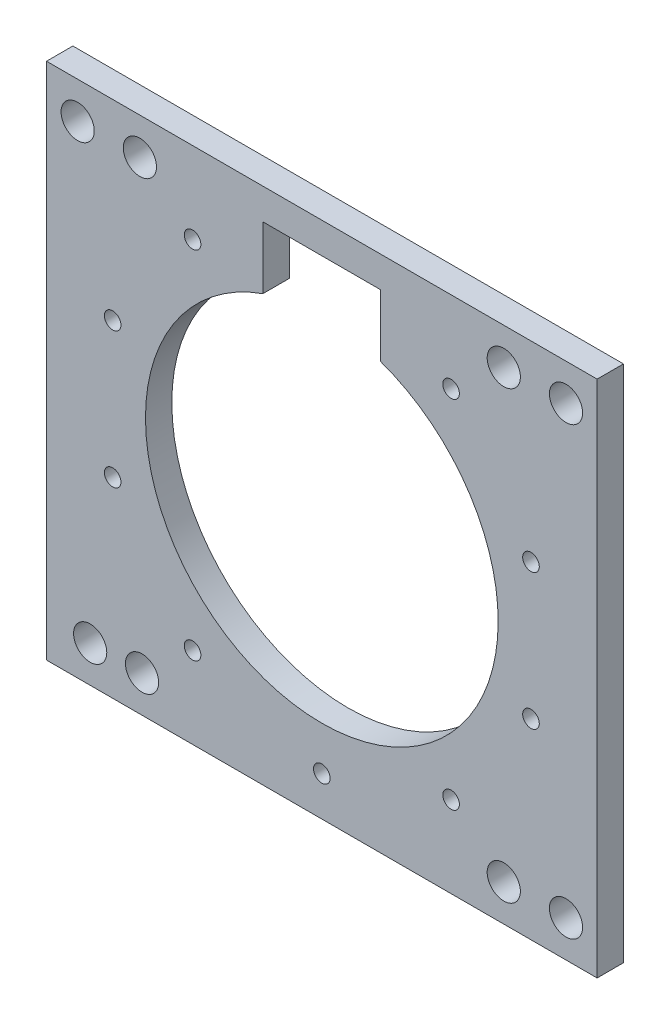
from build123d import *

# Parameters (mm, degrees)
SKETCH2_W           = 132.7
SKETCH2_H           = 125
BOSS_EXTRUDE1_DEPTH = 6.35
SKETCH1_R           = 2
CUT_EXTRUDE1_DEPTH  = 6.35
SKETCH6_R           = 4
CUT_EXTRUDE3_DEPTH  = 6.35


with BuildPart() as part:
    # Sketch2 → Boss-Extrude1 (new body)
    with BuildSketch(Plane.XY):
        with Locations((-0.075710713, -0.302842853)):
            Rectangle(SKETCH2_W, SKETCH2_H)
    extrude(amount=BOSS_EXTRUDE1_DEPTH)

    # Sketch1 → Cut-Extrude1 (cut)
    with BuildSketch(Plane.XY):
        with Locations(Location((-50.481706077, 16.075057848, 0), (0, 0, 180))):
            Circle(SKETCH1_R)
        with Locations(Location((-50.481706077, -16.680743555, 0), (0, 0, 180))):
            Circle(SKETCH1_R)
        with Locations(Location((-31.228329085, -43.180743555, 0), (0, 0, 180))):
            Circle(SKETCH1_R)
        with Locations(Location((-0.075710713, -53.302842853, 0), (0, 0, 180))):
            Circle(SKETCH1_R)
        with Locations(Location((31.076907658, -43.180743555, 0), (0, 0, 180))):
            Circle(SKETCH1_R)
        with Locations(Location((50.33028465, -16.680743555, 0), (0, 0, 180))):
            Circle(SKETCH1_R)
        with Locations(Location((50.33028465, 16.075057848, 0), (0, 0, 180))):
            Circle(SKETCH1_R)
        with Locations(Location((31.076907658, 42.575057848, 0), (0, 0, 180))):
            Circle(SKETCH1_R)
        with Locations(Location((-31.228329085, 42.575057848, 0), (0, 0, 180))):
            Circle(SKETCH1_R)
        with BuildLine():
            Line((-14.275710713, 39.754740698), (-14.275710713, 54.754740698))
            Line((-14.275710713, 54.754740698), (14.124289287, 54.754740698))
            Line((14.124289287, 54.754740698), (14.124289287, 39.754740698))
            ThreePointArc((14.124289287, 39.754740698), (-0.075710713, -42.802842853), (-14.275710713, 39.754740698))
        make_face()
    extrude(amount=CUT_EXTRUDE1_DEPTH, mode=Mode.SUBTRACT)

    # Sketch6 → Cut-Extrude3 (cut)
    with BuildSketch(Plane.XY.offset(6.35)):
        with Locations((58.774289287, -53.990342854)):
            Circle(SKETCH6_R)
        with Locations((43.774289287, -53.990342854)):
            Circle(SKETCH6_R)
        with Locations((-55.903321393, -53.990342853)):
            Circle(SKETCH6_R)
        with Locations((-43.403321393, -53.990342853)):
            Circle(SKETCH6_R)
        with Locations((-58.925710713, 53.384657146)):
            Circle(SKETCH6_R)
        with Locations((-43.925710713, 53.384657146)):
            Circle(SKETCH6_R)
        with Locations((43.774289287, 53.384657147)):
            Circle(SKETCH6_R)
        with Locations((58.774289287, 53.384657147)):
            Circle(SKETCH6_R)
    extrude(amount=-CUT_EXTRUDE3_DEPTH, mode=Mode.SUBTRACT)


solid = part.part
